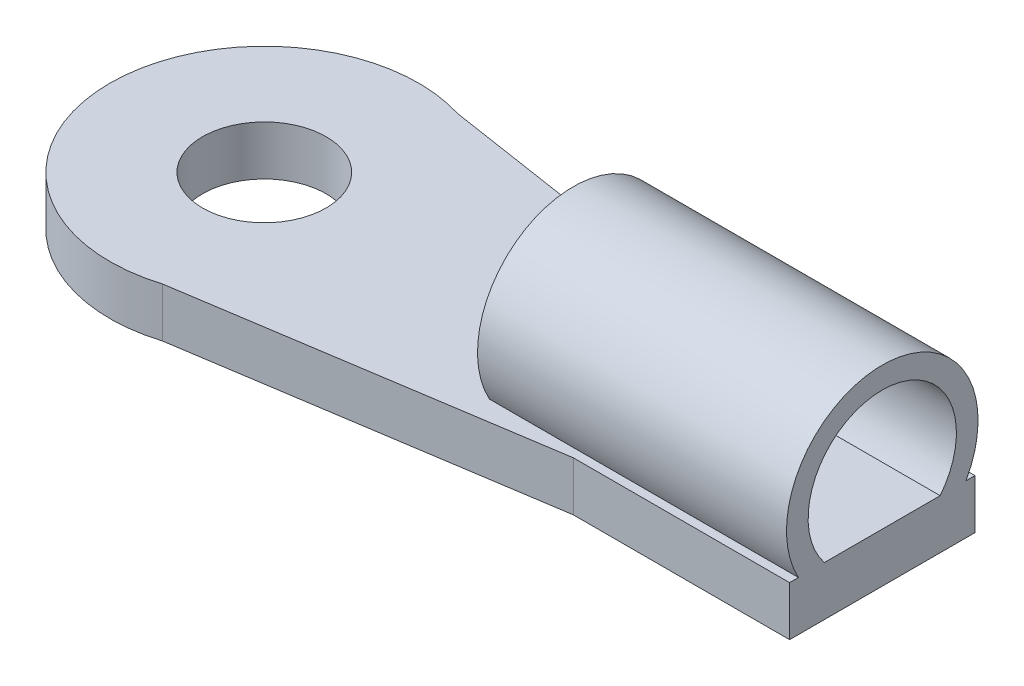
from build123d import *

# Parameters (mm, degrees)
SKETCH1_R           = 1
BOSS_EXTRUDE1_DEPTH = 0.8
BOSS_EXTRUDE4_DEPTH = 5


with BuildPart() as part:
    # Sketch1 → Boss-Extrude1 (new body)
    with BuildSketch(Plane(origin=(0, 0, 0), x_dir=(1, 0, 0), z_dir=(0, 1, 0))):
        with BuildLine():
            Line((6.5, 1.5), (0.738689027, 2.388375708))
            ThreePointArc((0.738689027, 2.388375708), (-2.5, 0), (0.738689027, -2.388375708))
            Line((0.738689027, -2.388375708), (6.5, -1.5))
            Line((6.5, -1.5), (10, -1.5))
            Line((10, -1.5), (10, 1.5))
            Line((10, 1.5), (6.5, 1.5))
        make_face()
        with Locations(Location((0, 0, 0), (0, 0, 270))):
            Circle(SKETCH1_R, mode=Mode.SUBTRACT)
    extrude(amount=BOSS_EXTRUDE1_DEPTH)

    # Sketch5 → Boss-Extrude4 (add)
    with BuildSketch(Plane(origin=(10, 0, 0), x_dir=(0, 0, -1), z_dir=(1, 0, 0))):
        with BuildLine():
            ThreePointArc((1.356465997, 0.8), (1.500836816, 1.162716057), (1.55, 1.55))
            ThreePointArc((1.55, 1.55), (-0.387283943, 3.050836816), (-1.356465997, 0.8))
            Line((-1.356465997, 0.8), (-0.9367497, 0.8))
            ThreePointArc((-0.9367497, 0.8), (-0.397429466, 2.682276388), (1.2, 1.55))
            ThreePointArc((1.2, 1.55), (1.132276388, 1.152570534), (0.9367497, 0.8))
            Line((0.9367497, 0.8), (1.356465997, 0.8))
        make_face()
        with BuildLine():
            Line((-0.9367497, 0.8), (-1.356465997, 0.8))
            ThreePointArc((-1.356465997, 0.8), (0, 0), (1.356465997, 0.8))
            Line((1.356465997, 0.8), (0.9367497, 0.8))
            ThreePointArc((0.9367497, 0.8), (0, 0.35), (-0.9367497, 0.8))
        make_face()
    extrude(amount=-BOSS_EXTRUDE4_DEPTH)


solid = part.part
